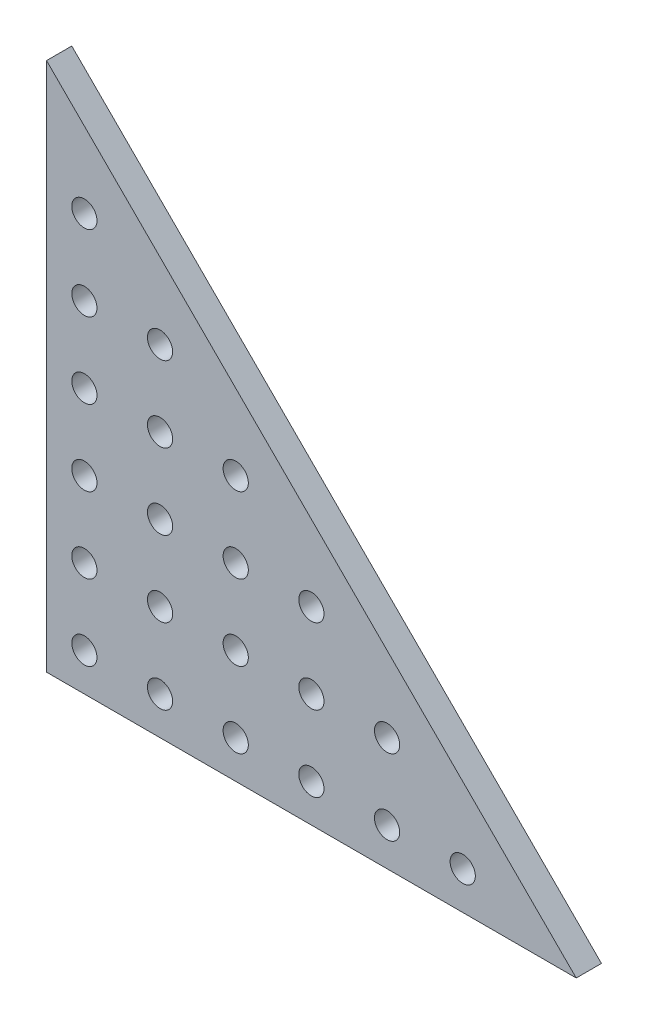
from build123d import *

# Parameters (mm, degrees)
MODEL_R                 = 1.5
SALIENTE_EXTRUIR1_DEPTH = 3


with BuildPart() as part:
    # Model → Saliente-Extruir1 (new body)
    with BuildSketch(Plane.XY):
        Polygon((-105.943383637, 105.556539338), (-105.943383637, 42.556539338), (-42.943383637, 42.556539338), align=None)
        with Locations((-101.443383637, 92.056539338)):
            Circle(MODEL_R, mode=Mode.SUBTRACT)
        with Locations((-101.443383637, 83.056539338)):
            Circle(MODEL_R, mode=Mode.SUBTRACT)
        with Locations((-92.443383637, 83.056539338)):
            Circle(MODEL_R, mode=Mode.SUBTRACT)
        with Locations((-101.443383637, 74.056539338)):
            Circle(MODEL_R, mode=Mode.SUBTRACT)
        with Locations((-92.443383637, 74.056539338)):
            Circle(MODEL_R, mode=Mode.SUBTRACT)
        with Locations((-83.443383637, 74.056539338)):
            Circle(MODEL_R, mode=Mode.SUBTRACT)
        with Locations((-101.443383637, 65.056539338)):
            Circle(MODEL_R, mode=Mode.SUBTRACT)
        with Locations((-92.443383637, 65.056539338)):
            Circle(MODEL_R, mode=Mode.SUBTRACT)
        with Locations((-83.443383637, 65.056539338)):
            Circle(MODEL_R, mode=Mode.SUBTRACT)
        with Locations((-74.443383637, 65.056539338)):
            Circle(MODEL_R, mode=Mode.SUBTRACT)
        with Locations((-101.443383637, 56.056539338)):
            Circle(MODEL_R, mode=Mode.SUBTRACT)
        with Locations((-92.443383637, 56.056539338)):
            Circle(MODEL_R, mode=Mode.SUBTRACT)
        with Locations((-83.443383637, 56.056539338)):
            Circle(MODEL_R, mode=Mode.SUBTRACT)
        with Locations((-74.443383637, 56.056539338)):
            Circle(MODEL_R, mode=Mode.SUBTRACT)
        with Locations((-65.443383637, 56.056539338)):
            Circle(MODEL_R, mode=Mode.SUBTRACT)
        with Locations((-101.443383637, 47.056539338)):
            Circle(MODEL_R, mode=Mode.SUBTRACT)
        with Locations((-92.443383637, 47.056539338)):
            Circle(MODEL_R, mode=Mode.SUBTRACT)
        with Locations((-83.443383637, 47.056539338)):
            Circle(MODEL_R, mode=Mode.SUBTRACT)
        with Locations((-74.443383637, 47.056539338)):
            Circle(MODEL_R, mode=Mode.SUBTRACT)
        with Locations((-65.443383637, 47.056539338)):
            Circle(MODEL_R, mode=Mode.SUBTRACT)
        with Locations((-56.443383637, 47.056539338)):
            Circle(MODEL_R, mode=Mode.SUBTRACT)
    extrude(amount=SALIENTE_EXTRUIR1_DEPTH)


solid = part.part
